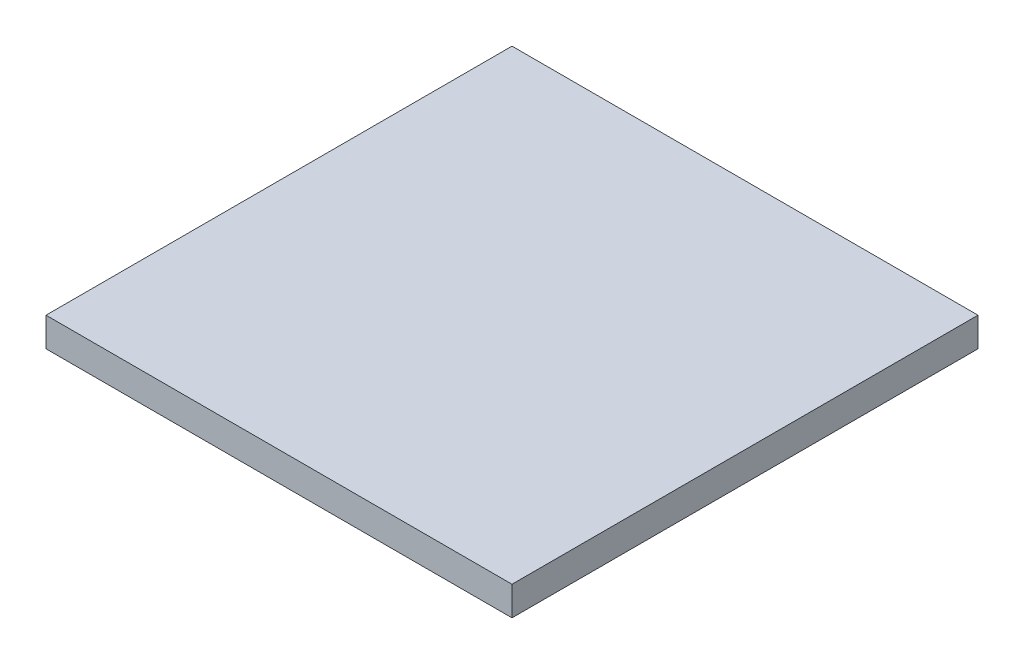
from build123d import *

# Parameters (mm, degrees)
SKETCH1_W           = 609.6
SKETCH1_H           = 609.6
BOSS_EXTRUDE1_DEPTH = 38.1


with BuildPart() as part:
    # Sketch1 → Boss-Extrude1 (new body)
    with BuildSketch(Plane(origin=(0, 0, 0), x_dir=(1, 0, 0), z_dir=(0, 1, 0))):
        Rectangle(SKETCH1_W, SKETCH1_H)
    extrude(amount=BOSS_EXTRUDE1_DEPTH)


solid = part.part
